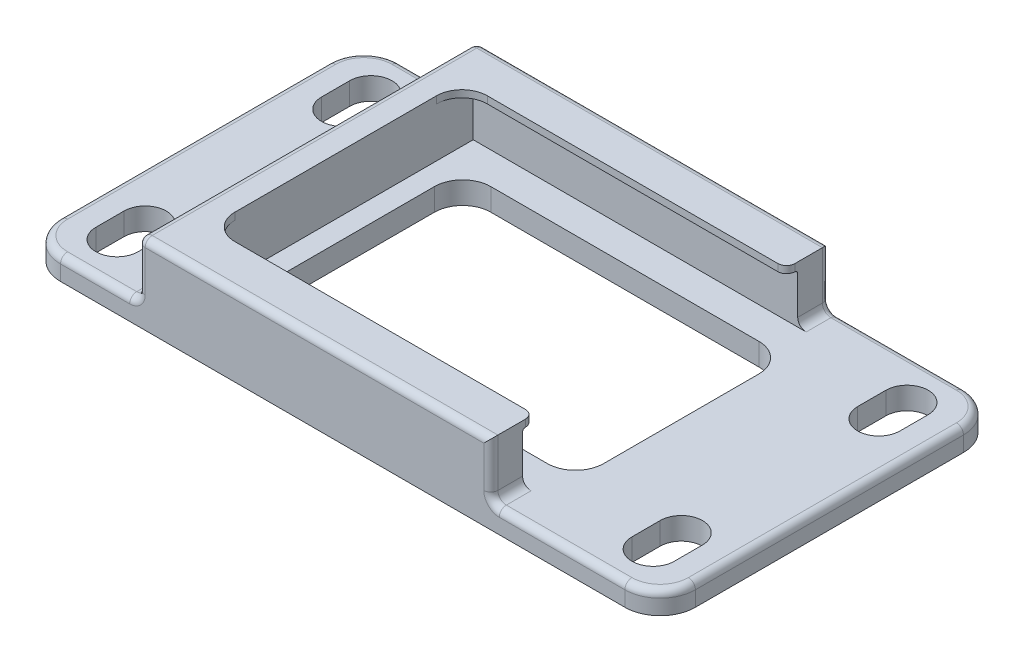
from build123d import *

# Parameters (mm, degrees)
BOSS_EXTRUDE1_DEPTH = 15.24
CUT_EXTRUDE1_DEPTH  = 19.05
CUT_EXTRUDE2_DEPTH  = 29.21
CUT_EXTRUDE4_REACH  = 35.15
SKETCH7_W           = 29.21
SKETCH7_H           = 19.05
FILLET3_R           = 2.54
FILLET6_R           = 0.762
FILLET7_R           = 2.286
FILLET9_R           = 3.175
FILLET10_R          = 0.762
FILLET11_R          = 0.635
FILLET12_R          = 0.254


with BuildPart() as part:
    # Sketch1 → Boss-Extrude1 (new, symmetric)
    with BuildSketch(Plane.XY):
        Polygon((-28.575, 0), (-28.575, 2), (-18.415, 2), (-18.415, 7.08), (13.335, 7.08), (13.335, 2), (28.575, 2), (28.575, 0), align=None)
    extrude(amount=BOSS_EXTRUDE1_DEPTH, both=True)

    # Sketch4 → Cut-Extrude1 (cut)
    with BuildSketch(Plane(origin=(0, 2, 0), x_dir=(1, 0, 0), z_dir=(0, 1, 0))):
        with BuildLine():
            Line((26.035, 11.43), (26.035, 8.89))
            ThreePointArc((26.035, 8.89), (24.13, 6.985), (22.225, 8.89))
            Line((22.225, 8.89), (22.225, 11.43))
            ThreePointArc((22.225, 11.43), (24.13, 13.335), (26.035, 11.43))
        make_face()
        with BuildLine():
            Line((26.035, -8.89), (26.035, -11.43))
            ThreePointArc((26.035, -11.43), (24.13, -13.335), (22.225, -11.43))
            Line((22.225, -11.43), (22.225, -8.89))
            ThreePointArc((22.225, -8.89), (24.13, -6.985), (26.035, -8.89))
        make_face()
        with BuildLine():
            Line((-22.225, 11.43), (-22.225, 8.89))
            ThreePointArc((-22.225, 8.89), (-24.13, 6.985), (-26.035, 8.89))
            Line((-26.035, 8.89), (-26.035, 11.43))
            ThreePointArc((-26.035, 11.43), (-24.13, 13.335), (-22.225, 11.43))
        make_face()
        with BuildLine():
            Line((-22.225, -8.89), (-22.225, -11.43))
            ThreePointArc((-22.225, -11.43), (-24.13, -13.335), (-26.035, -11.43))
            Line((-26.035, -11.43), (-26.035, -8.89))
            ThreePointArc((-26.035, -8.89), (-24.13, -6.985), (-22.225, -8.89))
        make_face()
    extrude(amount=-CUT_EXTRUDE1_DEPTH, mode=Mode.SUBTRACT)

    # Sketch5 → Cut-Extrude2 (cut)
    with BuildSketch(Plane(origin=(13.335, 0, 0), x_dir=(0, 0, -1), z_dir=(1, 0, 0))):
        Polygon((-12.3825, 2), (12.3825, 2), (12.3825, 6.445), (11.3665, 6.445), (11.3665, 7.08), (-11.3665, 7.08), (-11.3665, 6.445), (-12.3825, 6.445), align=None)
    extrude(amount=-CUT_EXTRUDE2_DEPTH, mode=Mode.SUBTRACT)

    # Sketch7 → Cut-Extrude4 (cut, up to next)
    with BuildSketch(Plane.XZ, mode=Mode.PRIVATE) as cut_extrude4_sk1:
        with Locations((0.635, 0)):
            Rectangle(SKETCH7_W, SKETCH7_H)
    cut_extrude4_tool1 = extrude(cut_extrude4_sk1.sketch, amount=-CUT_EXTRUDE4_REACH, mode=Mode.PRIVATE) & part.part
    add(cut_extrude4_tool1.solids().sort_by_distance((0.635, 0, 0))[0], mode=Mode.SUBTRACT)

    # Fillet3
    fillet3_edges = [part.edges().sort_by_distance(p)[0] for p in [
        (15.24, 1, 9.525),
        (15.24, 1, -9.525),
        (-13.97, 1, -9.525),
        (-13.97, 1, 9.525),
    ]]
    fillet(fillet3_edges, radius=FILLET3_R)

    # Fillet6
    fillet6_edges = [part.edges().sort_by_distance(p)[0] for p in [
        (13.335, 6.7625, -11.3665),
        (13.335, 6.7625, 11.3665),
    ]]
    fillet(fillet6_edges, radius=FILLET6_R)

    # Fillet7
    fillet7_edges = [part.edges().sort_by_distance(p)[0] for p in [
        (-15.875, 6.7625, 11.3665),
        (-15.875, 6.7625, -11.3665),
    ]]
    fillet(fillet7_edges, radius=FILLET7_R)

    # Fillet9
    fillet9_edges = [part.edges().sort_by_distance(p)[0] for p in [
        (28.575, 1, -15.24),
        (-28.575, 1, 15.24),
        (-28.575, 1, -15.24),
        (28.575, 1, 15.24),
    ]]
    fillet(fillet9_edges, radius=FILLET9_R)

    # Fillet10
    fillet10_edges = [part.edges().sort_by_distance(p)[0] for p in [
        (13.335, 2, -13.81125),
        (-18.415, 2, 0),
        (13.335, 2, 13.81125),
    ]]
    fillet(fillet10_edges, radius=FILLET10_R)

    # Fillet11
    fillet11_edges = [part.edges().sort_by_distance(p)[0] for p in [
        (-18.415, 7.08, 0),
        (-2.54, 7.08, 15.24),
        (19.7485, 2, 15.24),
        (-28.575, 2, 0),
        (-27.64506403, 2, -14.31006403),
        (-27.64506403, 2, 14.31006403),
        (19.7485, 2, -15.24),
        (28.575, 2, 0),
        (27.64506403, 2, -14.31006403),
        (27.64506403, 2, 14.31006403),
        (13.335, 4.921, 15.24),
        (13.335, 4.921, -15.24),
        (-22.2885, 2, 15.24),
        (-18.415, 4.921, 15.24),
        (-22.2885, 2, -15.24),
        (13.558184633, 2.223184633, 15.24),
        (13.558184633, 2.223184633, -15.24),
        (-18.638184633, 2.223184633, -15.24),
        (-18.638184633, 2.223184633, 15.24),
        (-18.415, 4.921, -15.24),
        (-2.54, 7.08, -15.24),
    ]]
    fillet(fillet11_edges, radius=FILLET11_R)

    # Fillet12
    fillet12_edges = [part.edges().sort_by_distance(p)[0] for p in [
        (-1.27, 6.445, -12.3825),
        (-1.27, 6.445, 12.3825),
    ]]
    fillet(fillet12_edges, radius=FILLET12_R)


solid = part.part
